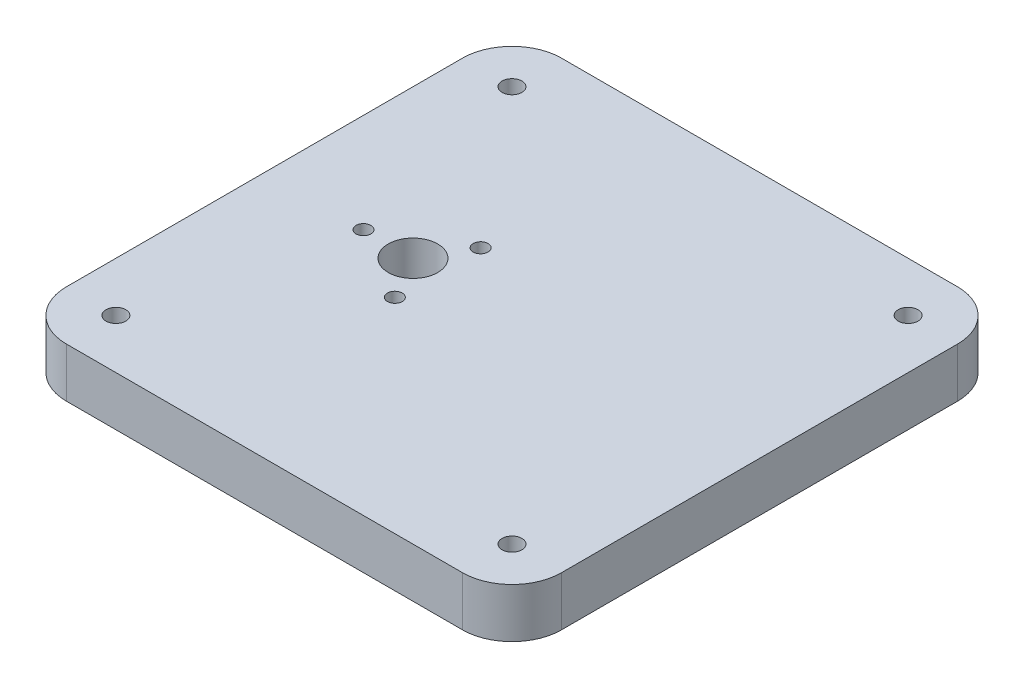
from build123d import *

# Parameters (mm, degrees)
SKETCH_1_R      = 2
SKETCH_1_R_2    = 5
SKETCH_1_R_3    = 1.5
EXTRUDE_1_DEPTH = 10


with BuildPart() as part:
    # 草图1 → 凸台-拉伸1 (new body)
    with BuildSketch(Plane(origin=(0, 0, 0), x_dir=(1, 0, 0), z_dir=(0, 1, 0))):
        with BuildLine():
            Line((-50.9375, 34.9609375), (29.0625, 34.9609375))
            ThreePointArc((29.0625, 34.9609375), (36.133567812, 32.032005312), (39.0625, 24.9609375))
            Line((39.0625, 24.9609375), (39.0625, -55.0390625))
            ThreePointArc((39.0625, -55.0390625), (36.133567812, -62.110130312), (29.0625, -65.0390625))
            Line((29.0625, -65.0390625), (-50.9375, -65.0390625))
            ThreePointArc((-50.9375, -65.0390625), (-58.008567812, -62.110130312), (-60.9375, -55.0390625))
            Line((-60.9375, -55.0390625), (-60.9375, 24.9609375))
            ThreePointArc((-60.9375, 24.9609375), (-58.008567812, 32.032005312), (-50.9375, 34.9609375))
        make_face()
        with Locations(Location((-50.9375, 24.9609375, 0), (0, 0, 270))):
            Circle(SKETCH_1_R, mode=Mode.SUBTRACT)
        with Locations(Location((-50.9375, -55.0390625, 0), (0, 0, 270))):
            Circle(SKETCH_1_R, mode=Mode.SUBTRACT)
        with Locations(Location((29.0625, 24.9609375, 0), (0, 0, 270))):
            Circle(SKETCH_1_R, mode=Mode.SUBTRACT)
        with Locations(Location((29.0625, -55.0390625, 0), (0, 0, 270))):
            Circle(SKETCH_1_R, mode=Mode.SUBTRACT)
        with Locations(Location((-30.9375, -15.0390625, 0), (0, 0, 270))):
            Circle(SKETCH_1_R_2, mode=Mode.SUBTRACT)
        with Locations(Location((-40.9375, -15.0390625, 0), (0, 0, 270))):
            Circle(SKETCH_1_R_3, mode=Mode.SUBTRACT)
        with Locations(Location((-25.9375, -23.699316538, 0), (0, 0, 270))):
            Circle(SKETCH_1_R_3, mode=Mode.SUBTRACT)
        with Locations(Location((-25.9375, -6.378808462, 0), (0, 0, 270))):
            Circle(SKETCH_1_R_3, mode=Mode.SUBTRACT)
    extrude(amount=EXTRUDE_1_DEPTH)


solid = part.part
